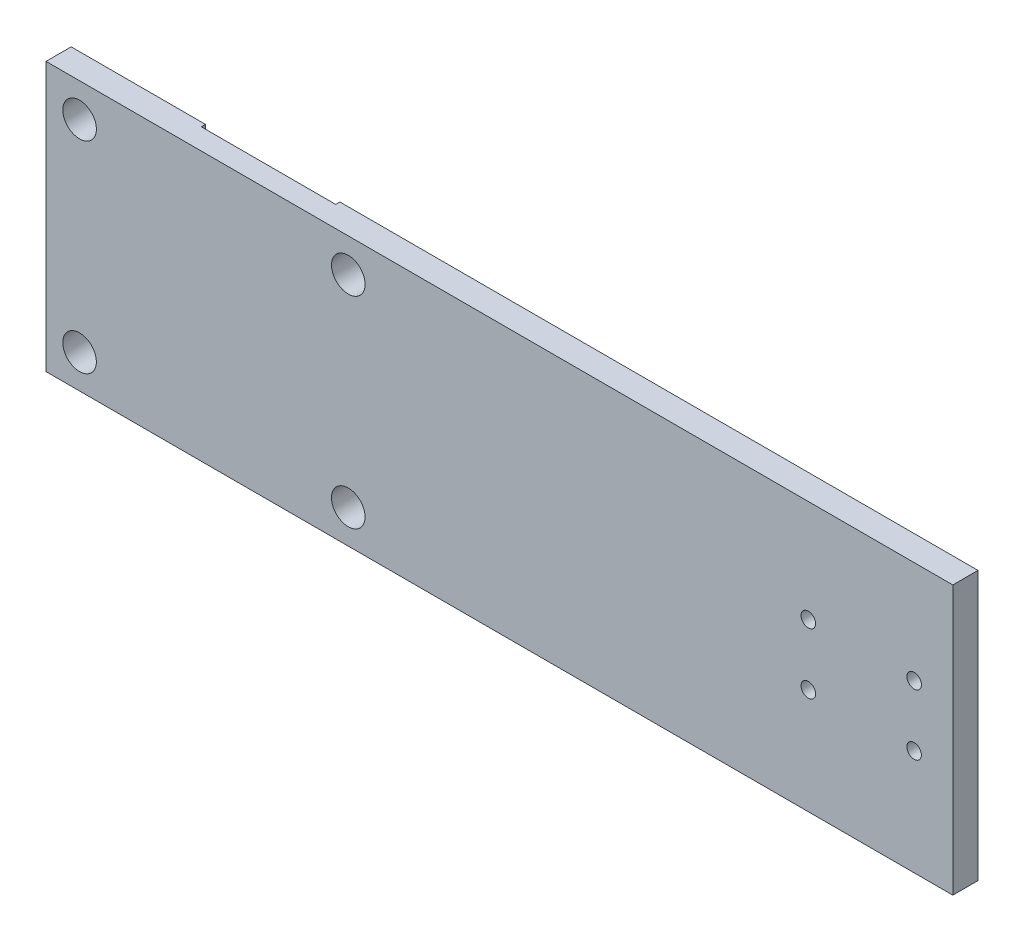
from build123d import *

# Parameters (mm, degrees)
SKETCH1_W               = 342.9
SKETCH1_H               = 101.6
BOSS_EXTRUDE1_DEPTH     = 9.525
CUT_EXTRUDE1_DEPTH      = 208.28
CUT_EXTRUDE1_DEPTH_BACK = 9.525
CUT_EXTRUDE1_START      = 60.325
SKETCH2_W               = 1.5875
SKETCH2_H               = 50.8
CUT_EXTRUDE4_DEPTH      = 358.76206566
CUT_EXTRUDE4_DEPTH_BACK = 358.76206566
SKETCH3_R               = 6.35
SKETCH5_W               = 50.8
SKETCH5_H               = 101.6
CUT_EXTRUDE5_DEPTH      = 1.5875
M5_CLEARANCE_HOLE1_D    = 5.5


with BuildPart() as part:
    # Sketch1 → Boss-Extrude1 (new body)
    with BuildSketch(Plane.XY):
        with Locations((171.45, 50.8)):
            Rectangle(SKETCH1_W, SKETCH1_H)
    extrude(amount=BOSS_EXTRUDE1_DEPTH)

    # Sketch2 → Cut-Extrude1 (cut, two sides: drawn at the far end of the back side and taken through both)
    with BuildSketch(Plane(origin=(0, 0, 0), x_dir=(0, 0, -1), z_dir=(1, 0, 0)).offset(CUT_EXTRUDE1_START - CUT_EXTRUDE1_DEPTH_BACK)):
        with Locations((-0.79375, 50.8)):
            Rectangle(SKETCH2_W, SKETCH2_H)
    extrude(amount=CUT_EXTRUDE1_DEPTH + CUT_EXTRUDE1_DEPTH_BACK, mode=Mode.SUBTRACT)

    # Sketch3 → Cut-Extrude4 (cut, two sides: drawn at the far end of the back side and taken through both)
    with BuildSketch(Plane(origin=(0, 0, 0), x_dir=(-1, 0, 0), z_dir=(0, 0, -1)).offset(-CUT_EXTRUDE4_DEPTH_BACK)):
        with Locations((-12.7, 88.9)):
            Circle(SKETCH3_R)
        with Locations((-114.3, 88.9)):
            Circle(SKETCH3_R)
        with Locations((-114.3, 12.7)):
            Circle(SKETCH3_R)
        with Locations((-12.7, 12.7)):
            Circle(SKETCH3_R)
    extrude(amount=CUT_EXTRUDE4_DEPTH + CUT_EXTRUDE4_DEPTH_BACK, mode=Mode.SUBTRACT)

    # Sketch5 → Cut-Extrude5 (cut)
    with BuildSketch(Plane(origin=(0, 0, 0), x_dir=(-1, 0, 0), z_dir=(0, 0, -1))):
        with Locations((-76.2, 50.8)):
            Rectangle(SKETCH5_W, SKETCH5_H)
    extrude(amount=-CUT_EXTRUDE5_DEPTH, mode=Mode.SUBTRACT)

    # M5 Clearance Hole1 (through all)
    with Locations(Plane.XY.offset(9.525)):
        with Locations((328.2696, 62.9412), (328.2696, 39.9288), (288.2646, 39.9288), (288.2646, 62.9412)):
            Hole(M5_CLEARANCE_HOLE1_D / 2)


solid = part.part
